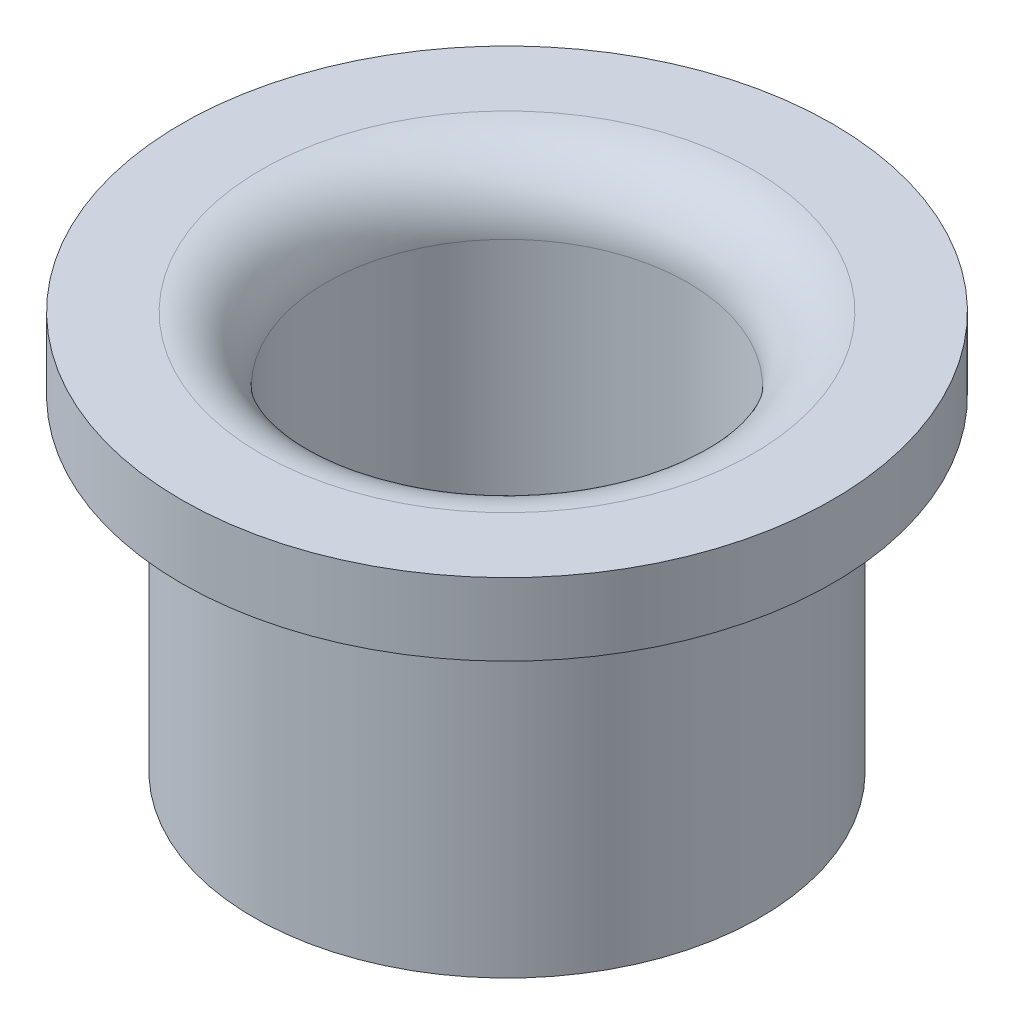
from build123d import *


with BuildPart() as part:
    # Esquisse1 → Base-Révolution (revolve)
    with BuildSketch(Plane.XY, mode=Mode.PRIVATE) as base_r_volution_sk:
        with BuildLine():
            Line((5, 0), (5, 9.2))
            ThreePointArc((5, 9.2), (5.527207794, 10.472792206), (6.8, 11))
            Line((6.8, 11), (9, 11))
            Line((9, 11), (9, 9))
            Line((9, 9), (7.8, 9))
            ThreePointArc((7.8, 9), (7.234314575, 8.765685425), (7, 8.2))
            Line((7, 8.2), (7, 0))
            Line((7, 0), (5, 0))
        make_face()
    revolve(base_r_volution_sk.sketch.rotate(Axis((0, 0, 0), (0, 1, 0)), 90), axis=Axis((0, 0, 0), (0, 1, 0)))


solid = part.part
